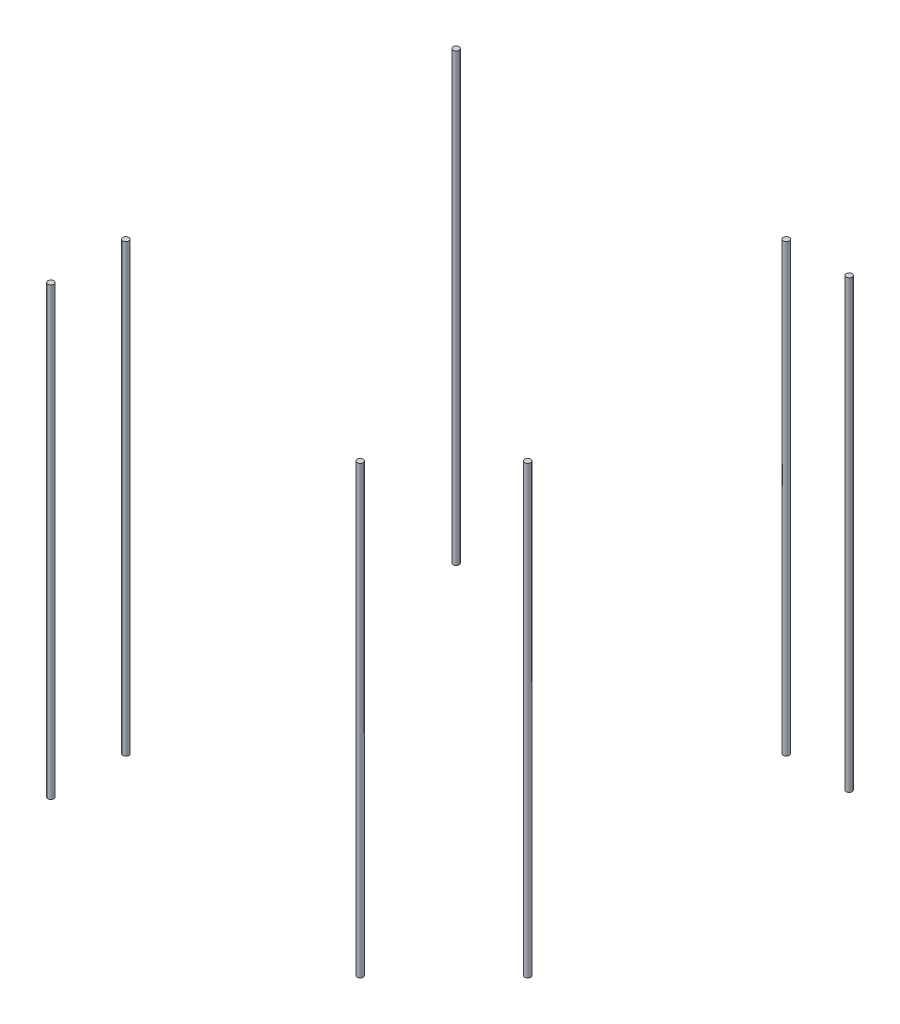
from build123d import *

# Parameters (mm, degrees)
EXTRUDE_1_DEPTH        = 20
EXTRUDE_1_DEPTH_BACK   = 420
SKETCH_1_R             = 3
EXTRUDE_1_2_DEPTH      = 20
EXTRUDE_1_2_DEPTH_BACK = 420
EXTRUDE_1_3_DEPTH      = 20
EXTRUDE_1_3_DEPTH_BACK = 420
EXTRUDE_1_4_DEPTH      = 20
EXTRUDE_1_4_DEPTH_BACK = 420
EXTRUDE_1_5_DEPTH      = 20
EXTRUDE_1_5_DEPTH_BACK = 420
EXTRUDE_1_6_DEPTH      = 20
EXTRUDE_1_6_DEPTH_BACK = 420
EXTRUDE_1_7_DEPTH      = 20
EXTRUDE_1_7_DEPTH_BACK = 420


with BuildPart() as part:
    # Эскиз1 → Бобышка-Вытянуть1 (new, two sides: drawn at the far end of the back side and taken through both)
    with BuildSketch(Plane(origin=(0, 0, 0), x_dir=(1, 0, 0), z_dir=(0, 1, 0)).offset(-EXTRUDE_1_DEPTH_BACK)):
        with Locations(Location((335, -9, 0), (0, 0, 270))):
            Circle(SKETCH_1_R)
    extrude(amount=EXTRUDE_1_DEPTH + EXTRUDE_1_DEPTH_BACK)


with BuildPart() as body_2:
    # Эскиз1 → Extrude 1 2 (new, two sides: drawn at the far end of the back side and taken through both)
    with BuildSketch(Plane(origin=(0, 0, 0), x_dir=(1, 0, 0), z_dir=(0, 1, 0)).offset(-EXTRUDE_1_2_DEPTH_BACK)):
        with Locations(Location((9, -9, 0), (0, 0, 270))):
            Circle(SKETCH_1_R)
    extrude(amount=EXTRUDE_1_2_DEPTH + EXTRUDE_1_2_DEPTH_BACK)


with BuildPart() as body_3:
    # Эскиз1 → Extrude 1 3 (new, two sides: drawn at the far end of the back side and taken through both)
    with BuildSketch(Plane(origin=(0, 0, 0), x_dir=(1, 0, 0), z_dir=(0, 1, 0)).offset(-EXTRUDE_1_3_DEPTH_BACK)):
        with Locations(Location((9, -335, 0), (0, 0, 270))):
            Circle(SKETCH_1_R)
    extrude(amount=EXTRUDE_1_3_DEPTH + EXTRUDE_1_3_DEPTH_BACK)


with BuildPart() as body_4:
    # Эскиз1 → Extrude 1 4 (new, two sides: drawn at the far end of the back side and taken through both)
    with BuildSketch(Plane(origin=(0, 0, 0), x_dir=(1, 0, 0), z_dir=(0, 1, 0)).offset(-EXTRUDE_1_4_DEPTH_BACK)):
        with Locations(Location((314.289321881, -409, 0), (0, 0, 270))):
            Circle(SKETCH_1_R)
    extrude(amount=EXTRUDE_1_4_DEPTH + EXTRUDE_1_4_DEPTH_BACK)


with BuildPart() as body_5:
    # Эскиз1 → Extrude 1 5 (new, two sides: drawn at the far end of the back side and taken through both)
    with BuildSketch(Plane(origin=(0, 0, 0), x_dir=(1, 0, 0), z_dir=(0, 1, 0)).offset(-EXTRUDE_1_5_DEPTH_BACK)):
        with Locations(Location((397, -326.289321881, 0), (0, 0, 270))):
            Circle(SKETCH_1_R)
    extrude(amount=EXTRUDE_1_5_DEPTH + EXTRUDE_1_5_DEPTH_BACK)


with BuildPart() as body_6:
    # Эскиз1 → Extrude 1 6 (new, two sides: drawn at the far end of the back side and taken through both)
    with BuildSketch(Plane(origin=(0, 0, 0), x_dir=(1, 0, 0), z_dir=(0, 1, 0)).offset(-EXTRUDE_1_6_DEPTH_BACK)):
        with Locations(Location((9, -409, 0), (0, 0, 270))):
            Circle(SKETCH_1_R)
    extrude(amount=EXTRUDE_1_6_DEPTH + EXTRUDE_1_6_DEPTH_BACK)


with BuildPart() as body_7:
    # Эскиз1 → Extrude 1 7 (new, two sides: drawn at the far end of the back side and taken through both)
    with BuildSketch(Plane(origin=(0, 0, 0), x_dir=(1, 0, 0), z_dir=(0, 1, 0)).offset(-EXTRUDE_1_7_DEPTH_BACK)):
        with Locations(Location((397, -9, 0), (0, 0, 270))):
            Circle(SKETCH_1_R)
    extrude(amount=EXTRUDE_1_7_DEPTH + EXTRUDE_1_7_DEPTH_BACK)


solid = Compound([part.part, body_2.part, body_3.part, body_4.part, body_5.part, body_6.part, body_7.part])
